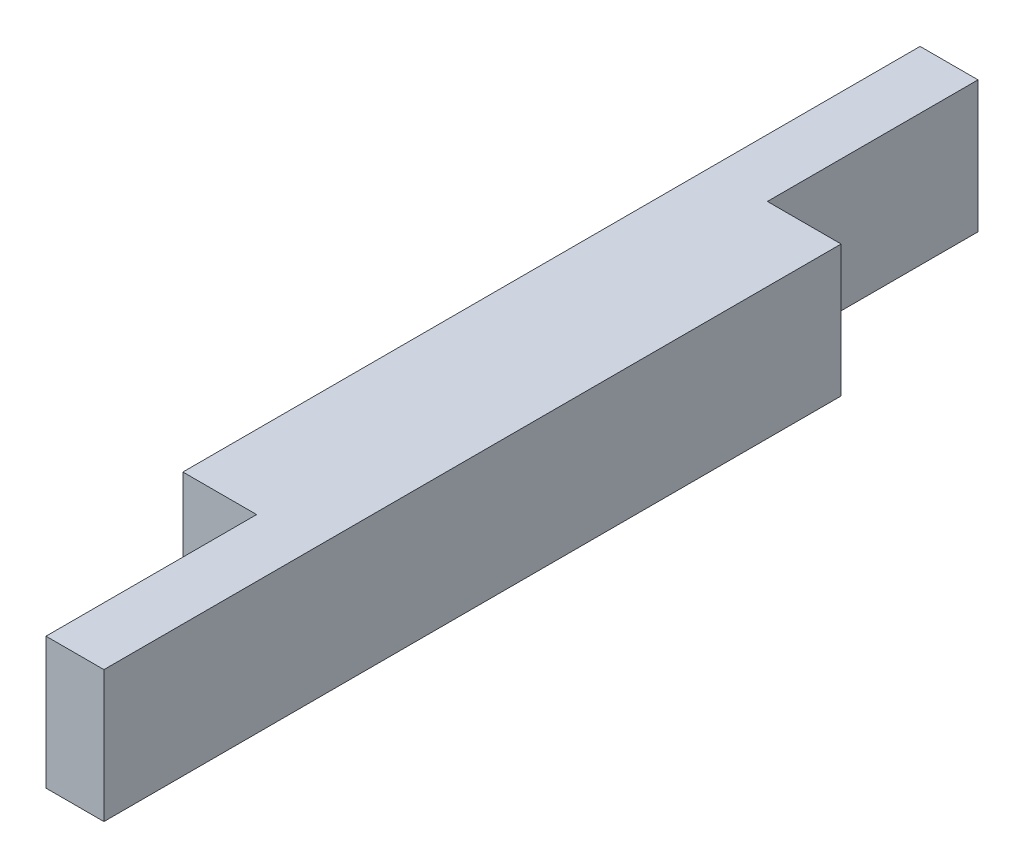
from build123d import *

# Parameters (mm, degrees)
SKETCH3_W           = 25
SKETCH3_H           = 180
BOSS_EXTRUDE1_DEPTH = 25
SKETCH4_W           = 14
SKETCH4_H           = 40
CUT_EXTRUDE1_DEPTH  = 183.157212319


with BuildPart() as part:
    # Sketch3 → Boss-Extrude1 (new body)
    with BuildSketch(Plane(origin=(0, 0, 0), x_dir=(1, 0, 0), z_dir=(0, 1, 0))):
        with Locations((0, 90)):
            Rectangle(SKETCH3_W, SKETCH3_H)
    extrude(amount=BOSS_EXTRUDE1_DEPTH)

    # Sketch4 → Cut-Extrude1 (cut, through all)
    with BuildSketch(Plane(origin=(0, 25, 0), x_dir=(1, 0, 0), z_dir=(0, 1, 0))):
        with Locations((5.5, 160)):
            Rectangle(SKETCH4_W, SKETCH4_H)
        with Locations((-5.5, 20)):
            Rectangle(SKETCH4_W, SKETCH4_H)
    extrude(amount=-CUT_EXTRUDE1_DEPTH, mode=Mode.SUBTRACT)


solid = part.part
